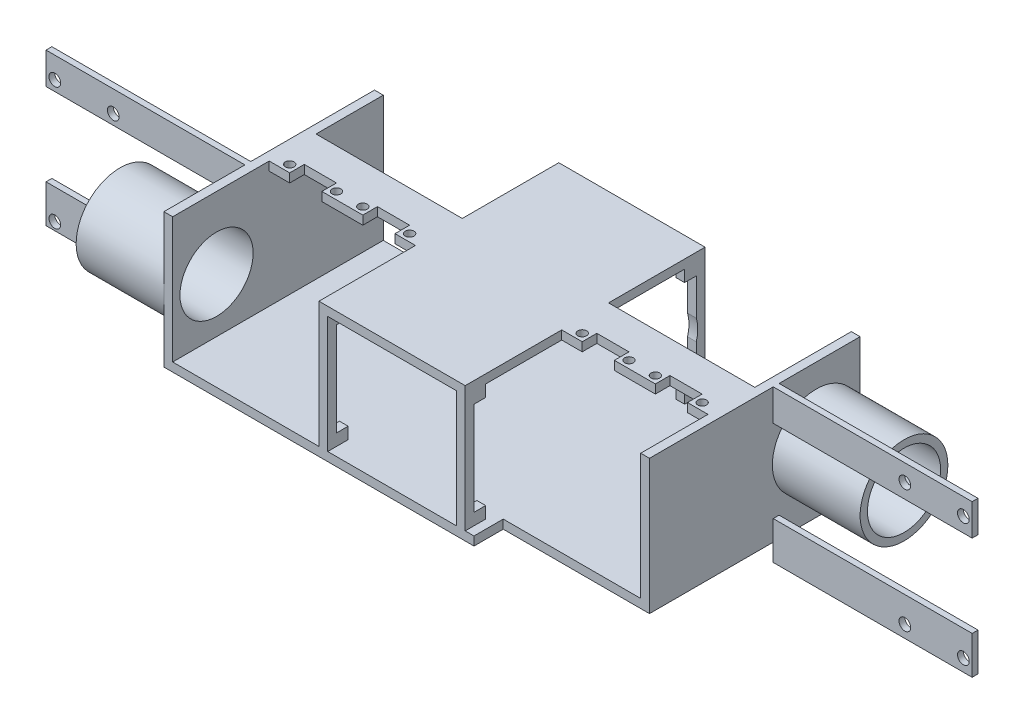
from build123d import *

# Parameters (mm, degrees)
SKETCH1_W               = 50
SKETCH1_H               = 46
BOSS_EXTRUDE1_DEPTH     = 41
CUT_EXTRUDE1_REACH      = 90.758
SKETCH2_W               = 44
SKETCH2_H               = 40
CUT_EXTRUDE2_DEPTH      = 69.629439747
CUT_EXTRUDE2_DEPTH_BACK = 69.629439747
SKETCH4_W               = 82
SKETCH4_H               = 3
BOSS_EXTRUDE2_DEPTH     = 50
SKETCH7_W               = 16
SKETCH7_H               = 3
BOSS_EXTRUDE4_DEPTH     = 50
SKETCH8_W               = 82
SKETCH8_H               = 46
BOSS_EXTRUDE5_DEPTH     = 3
CUT_EXTRUDE4_START      = -3
CUT_EXTRUDE4_DEPTH      = 103.403219264
CUT_EXTRUDE5_REACH      = 101.403
SKETCH10_W              = 11
SKETCH10_H              = 5
CUT_EXTRUDE6_REACH      = 101.403
SKETCH11_R              = 1.5
SKETCH12_R              = 15
BOSS_EXTRUDE6_DEPTH     = 30
SKETCH13_R              = 12.5
CUT_EXTRUDE7_DEPTH      = 142.063815346
SKETCH14_W              = 2
SKETCH14_H              = 10.8
SKETCH14_H_2            = 13
BOSS_EXTRUDE7_DEPTH     = 68
SKETCH16_R              = 15
BOSS_EXTRUDE8_DEPTH     = 30
CUT_EXTRUDE9_REACH      = 260.917
SKETCH17_R              = 12.5
SKETCH18_W              = 2
SKETCH18_H              = 10.8
BOSS_EXTRUDE9_DEPTH     = 68
SKETCH19_W              = 2
SKETCH19_H              = 13
BOSS_EXTRUDE10_DEPTH    = 68
CUT_EXTRUDE10_REACH     = 160.447
SKETCH15_R              = 2
CUT_EXTRUDE11_REACH     = 160.447
SKETCH20_R              = 2
CUT_EXTRUDE12_REACH     = 160.471
SKETCH21_W              = 50
SKETCH21_H              = 10
CUT_EXTRUDE13_REACH     = 160.471
SKETCH22_W              = 50
SKETCH22_H              = 10


with BuildPart() as part:
    # Sketch1 → Boss-Extrude1 (new, symmetric)
    with BuildSketch(Plane.XY):
        Rectangle(SKETCH1_W, SKETCH1_H)
    extrude(amount=BOSS_EXTRUDE1_DEPTH, both=True)

    # Sketch2 → Cut-Extrude1 (cut, up to next)
    with BuildSketch(Plane.XY.offset(41), mode=Mode.PRIVATE) as cut_extrude1_sk1:
        Rectangle(SKETCH2_W, SKETCH2_H)
    cut_extrude1_tool1 = extrude(cut_extrude1_sk1.sketch, amount=-CUT_EXTRUDE1_REACH, mode=Mode.PRIVATE) & part.part
    add(cut_extrude1_tool1.solids().sort_by_distance((0, 0, 41))[0], mode=Mode.SUBTRACT)

    # Sketch3 → Cut-Extrude2 (cut, two sides: drawn at the far end of the back side and taken through both)
    with BuildSketch(Plane.ZY.offset(25).offset(-CUT_EXTRUDE2_DEPTH_BACK)):
        Polygon((-34, 16), (-34, 20), (34, 20), (34, 16), (38, 16), (38, -16), (34, -16), (34, -20), (-34, -20), (-34, -16), (-38, -16), (-38, 16), align=None)
    extrude(amount=CUT_EXTRUDE2_DEPTH + CUT_EXTRUDE2_DEPTH_BACK, mode=Mode.SUBTRACT)

    # Sketch4 → Boss-Extrude2 (add)
    with BuildSketch(Plane(origin=(25, 0, 0), x_dir=(0, 0, -1), z_dir=(1, 0, 0))):
        with Locations((0, -21.5)):
            Rectangle(SKETCH4_W, SKETCH4_H)
    boss_extrude2 = extrude(amount=BOSS_EXTRUDE2_DEPTH)

    # Sketch7 → Boss-Extrude4 (add)
    with BuildSketch(Plane(origin=(25, 0, 0), x_dir=(0, 0, -1), z_dir=(1, 0, 0))):
        with Locations((0, 21.5)):
            Rectangle(SKETCH7_W, SKETCH7_H)
    boss_extrude4 = extrude(amount=BOSS_EXTRUDE4_DEPTH)

    # Sketch8 → Boss-Extrude5 (add)
    with BuildSketch(Plane(origin=(75, 0, 0), x_dir=(0, 0, -1), z_dir=(1, 0, 0))):
        Rectangle(SKETCH8_W, SKETCH8_H)
    boss_extrude5 = extrude(amount=BOSS_EXTRUDE5_DEPTH)

    # Sketch9 → Cut-Extrude4 (cut)
    with BuildSketch(Plane(origin=(0, 23, 0), x_dir=(1, 0, 0), z_dir=(0, 1, 0)).offset(CUT_EXTRUDE4_START)):
        Polygon((68, -228.237960416), (68, -8), (68, -3), (57, -3), (57, -8), (57, -228.237960416), (57, -668.713881249), (68, -668.713881249), align=None)
    cut_extrude4 = extrude(amount=CUT_EXTRUDE4_DEPTH, mode=Mode.SUBTRACT)

    # Sketch10 → Cut-Extrude5 (cut, up to next)
    with BuildSketch(Plane(origin=(0, 23, 0), x_dir=(1, 0, 0), z_dir=(0, 1, 0)), mode=Mode.PRIVATE) as cut_extrude5_sk1:
        with Locations((37.5, -5.5)):
            Rectangle(SKETCH10_W, SKETCH10_H)
    cut_extrude5_tool1 = extrude(cut_extrude5_sk1.sketch, amount=-CUT_EXTRUDE5_REACH, mode=Mode.PRIVATE) & part.part
    cut_extrude5 = cut_extrude5_tool1.solids().sort_by_distance((37.5, 23, 5.5))[0]
    add(cut_extrude5, mode=Mode.SUBTRACT)

    # Sketch11 → Cut-Extrude6 (cut, up to next)
    with BuildSketch(Plane(origin=(0, 23, 0), x_dir=(1, 0, 0), z_dir=(0, 1, 0)), mode=Mode.PRIVATE) as cut_extrude6_sk1:
        with Locations(Location((29.5, -5.5, 0), (0, 0, 270))):
            Circle(SKETCH11_R)
    cut_extrude6_tool1 = extrude(cut_extrude6_sk1.sketch, amount=-CUT_EXTRUDE6_REACH, mode=Mode.PRIVATE) & part.part
    # Sketch11 → Cut-Extrude6 (cut, up to next)
    with BuildSketch(Plane(origin=(0, 23, 0), x_dir=(1, 0, 0), z_dir=(0, 1, 0)), mode=Mode.PRIVATE) as cut_extrude6_sk2:
        with Locations(Location((45.5, -5.5, 0), (0, 0, 270))):
            Circle(SKETCH11_R)
    cut_extrude6_tool2 = extrude(cut_extrude6_sk2.sketch, amount=-CUT_EXTRUDE6_REACH, mode=Mode.PRIVATE) & part.part
    # Sketch11 → Cut-Extrude6 (cut, up to next)
    with BuildSketch(Plane(origin=(0, 23, 0), x_dir=(1, 0, 0), z_dir=(0, 1, 0)), mode=Mode.PRIVATE) as cut_extrude6_sk3:
        with Locations(Location((54.5, -5.5, 0), (0, 0, 270))):
            Circle(SKETCH11_R)
    cut_extrude6_tool3 = extrude(cut_extrude6_sk3.sketch, amount=-CUT_EXTRUDE6_REACH, mode=Mode.PRIVATE) & part.part
    # Sketch11 → Cut-Extrude6 (cut, up to next)
    with BuildSketch(Plane(origin=(0, 23, 0), x_dir=(1, 0, 0), z_dir=(0, 1, 0)), mode=Mode.PRIVATE) as cut_extrude6_sk4:
        with Locations(Location((70.5, -5.5, 0), (0, 0, 270))):
            Circle(SKETCH11_R)
    cut_extrude6_tool4 = extrude(cut_extrude6_sk4.sketch, amount=-CUT_EXTRUDE6_REACH, mode=Mode.PRIVATE) & part.part
    cut_extrude6_1 = cut_extrude6_tool1.solids().sort_by_distance((29.5, 23, 5.5))[0]
    add(cut_extrude6_1, mode=Mode.SUBTRACT)
    cut_extrude6_2 = cut_extrude6_tool2.solids().sort_by_distance((45.5, 23, 5.5))[0]
    add(cut_extrude6_2, mode=Mode.SUBTRACT)
    cut_extrude6_3 = cut_extrude6_tool3.solids().sort_by_distance((54.5, 23, 5.5))[0]
    add(cut_extrude6_3, mode=Mode.SUBTRACT)
    cut_extrude6_4 = cut_extrude6_tool4.solids().sort_by_distance((70.5, 23, 5.5))[0]
    add(cut_extrude6_4, mode=Mode.SUBTRACT)
    cut_extrude6 = cut_extrude6_1 + cut_extrude6_2 + cut_extrude6_3 + cut_extrude6_4  # Cut-Extrude6 as one shape, for the pattern or mirror that repeats it

    # Sketch12 → Boss-Extrude6 (add)
    with BuildSketch(Plane(origin=(78, 0, 0), x_dir=(0, 0, -1), z_dir=(1, 0, 0))):
        with Locations((26, 0)):
            Circle(SKETCH12_R)
    extrude(amount=BOSS_EXTRUDE6_DEPTH)

    # Sketch13 → Cut-Extrude7 (cut, through all)
    with BuildSketch(Plane(origin=(108, 0, 0), x_dir=(0, 0, -1), z_dir=(1, 0, 0))):
        with Locations((26, 0)):
            Circle(SKETCH13_R)
    extrude(amount=-CUT_EXTRUDE7_DEPTH, mode=Mode.SUBTRACT)

    # Sketch14 → Boss-Extrude7 (add)
    with BuildSketch(Plane(origin=(78, 0, 0), x_dir=(0, 0, -1), z_dir=(1, 0, 0))):
        with Locations((12.3, 17.6)):
            Rectangle(SKETCH14_W, SKETCH14_H)
        with Locations((12.3, -22.5)):
            Rectangle(SKETCH14_W, SKETCH14_H_2)
    extrude(amount=BOSS_EXTRUDE7_DEPTH)

    # Mirror1: Boss-Extrude2, Boss-Extrude4, Boss-Extrude5, Cut-Extrude4, Cut-Extrude5, Cut-Extrude6 across plane
    add(boss_extrude2.mirror(Plane(origin=(0, 0, 0), x_dir=(0, 0, 1), z_dir=(1, 0, 0))))
    add(boss_extrude4.mirror(Plane(origin=(0, 0, 0), x_dir=(0, 0, 1), z_dir=(1, 0, 0))))
    add(boss_extrude5.mirror(Plane(origin=(0, 0, 0), x_dir=(0, 0, 1), z_dir=(1, 0, 0))))
    add(cut_extrude4.mirror(Plane(origin=(0, 0, 0), x_dir=(0, 0, 1), z_dir=(1, 0, 0))), mode=Mode.SUBTRACT)
    add(cut_extrude5.mirror(Plane(origin=(0, 0, 0), x_dir=(0, 0, 1), z_dir=(1, 0, 0))), mode=Mode.SUBTRACT)
    add(cut_extrude6.mirror(Plane(origin=(0, 0, 0), x_dir=(0, 0, 1), z_dir=(1, 0, 0))), mode=Mode.SUBTRACT)

    # Sketch16 → Boss-Extrude8 (add)
    with BuildSketch(Plane.ZY.offset(78)):
        with Locations((26, -1.505120408)):
            Circle(SKETCH16_R)
    extrude(amount=BOSS_EXTRUDE8_DEPTH)

    # Sketch17 → Cut-Extrude9 (cut, up to next)
    with BuildSketch(Plane.ZY.offset(108), mode=Mode.PRIVATE) as cut_extrude9_sk1:
        with Locations((26, -1.505120408)):
            Circle(SKETCH17_R)
    cut_extrude9_tool1 = extrude(cut_extrude9_sk1.sketch, amount=-CUT_EXTRUDE9_REACH, mode=Mode.PRIVATE) & part.part
    add(cut_extrude9_tool1.solids().sort_by_distance((-108, -1.50512, 26))[0], mode=Mode.SUBTRACT)

    # Sketch18 → Boss-Extrude9 (add)
    with BuildSketch(Plane.ZY.offset(78)):
        with Locations((12.3, 17.6)):
            Rectangle(SKETCH18_W, SKETCH18_H)
    extrude(amount=BOSS_EXTRUDE9_DEPTH)

    # Sketch19 → Boss-Extrude10 (add)
    with BuildSketch(Plane.ZY.offset(78)):
        with Locations((12.3, -22.5)):
            Rectangle(SKETCH19_W, SKETCH19_H)
    extrude(amount=BOSS_EXTRUDE10_DEPTH)

    # Sketch15 → Cut-Extrude10 (cut, up to next)
    with BuildSketch(Plane(origin=(0, 0, -13.3), x_dir=(-1, 0, 0), z_dir=(0, 0, -1)), mode=Mode.PRIVATE) as cut_extrude10_sk1:
        with Locations(Location((-143, -24.8, 0), (0, 0, 90))):
            Circle(SKETCH15_R)
    cut_extrude10_tool1 = extrude(cut_extrude10_sk1.sketch, amount=-CUT_EXTRUDE10_REACH, mode=Mode.PRIVATE) & part.part
    # Sketch15 → Cut-Extrude10 (cut, up to next)
    with BuildSketch(Plane(origin=(0, 0, -13.3), x_dir=(-1, 0, 0), z_dir=(0, 0, -1)), mode=Mode.PRIVATE) as cut_extrude10_sk2:
        with Locations(Location((-123, -24.8, 0), (0, 0, 90))):
            Circle(SKETCH15_R)
    cut_extrude10_tool2 = extrude(cut_extrude10_sk2.sketch, amount=-CUT_EXTRUDE10_REACH, mode=Mode.PRIVATE) & part.part
    # Sketch15 → Cut-Extrude10 (cut, up to next)
    with BuildSketch(Plane(origin=(0, 0, -13.3), x_dir=(-1, 0, 0), z_dir=(0, 0, -1)), mode=Mode.PRIVATE) as cut_extrude10_sk3:
        with Locations(Location((-123, 17.2, 0), (0, 0, 90))):
            Circle(SKETCH15_R)
    cut_extrude10_tool3 = extrude(cut_extrude10_sk3.sketch, amount=-CUT_EXTRUDE10_REACH, mode=Mode.PRIVATE) & part.part
    # Sketch15 → Cut-Extrude10 (cut, up to next)
    with BuildSketch(Plane(origin=(0, 0, -13.3), x_dir=(-1, 0, 0), z_dir=(0, 0, -1)), mode=Mode.PRIVATE) as cut_extrude10_sk4:
        with Locations(Location((-143, 17.2, 0), (0, 0, 90))):
            Circle(SKETCH15_R)
    cut_extrude10_tool4 = extrude(cut_extrude10_sk4.sketch, amount=-CUT_EXTRUDE10_REACH, mode=Mode.PRIVATE) & part.part
    add(cut_extrude10_tool1.solids().sort_by_distance((143, -24.8, -13.3))[0], mode=Mode.SUBTRACT)
    add(cut_extrude10_tool2.solids().sort_by_distance((123, -24.8, -13.3))[0], mode=Mode.SUBTRACT)
    add(cut_extrude10_tool3.solids().sort_by_distance((123, 17.2, -13.3))[0], mode=Mode.SUBTRACT)
    add(cut_extrude10_tool4.solids().sort_by_distance((143, 17.2, -13.3))[0], mode=Mode.SUBTRACT)

    # Sketch20 → Cut-Extrude11 (cut, up to next)
    with BuildSketch(Plane.XY.offset(13.3), mode=Mode.PRIVATE) as cut_extrude11_sk1:
        with Locations((-123, 15.694879592)):
            Circle(SKETCH20_R)
    cut_extrude11_tool1 = extrude(cut_extrude11_sk1.sketch, amount=-CUT_EXTRUDE11_REACH, mode=Mode.PRIVATE) & part.part
    # Sketch20 → Cut-Extrude11 (cut, up to next)
    with BuildSketch(Plane.XY.offset(13.3), mode=Mode.PRIVATE) as cut_extrude11_sk2:
        with Locations((-143, 15.694879592)):
            Circle(SKETCH20_R)
    cut_extrude11_tool2 = extrude(cut_extrude11_sk2.sketch, amount=-CUT_EXTRUDE11_REACH, mode=Mode.PRIVATE) & part.part
    # Sketch20 → Cut-Extrude11 (cut, up to next)
    with BuildSketch(Plane.XY.offset(13.3), mode=Mode.PRIVATE) as cut_extrude11_sk3:
        with Locations((-123, -26.305120408)):
            Circle(SKETCH20_R)
    cut_extrude11_tool3 = extrude(cut_extrude11_sk3.sketch, amount=-CUT_EXTRUDE11_REACH, mode=Mode.PRIVATE) & part.part
    # Sketch20 → Cut-Extrude11 (cut, up to next)
    with BuildSketch(Plane.XY.offset(13.3), mode=Mode.PRIVATE) as cut_extrude11_sk4:
        with Locations((-143, -26.305120408)):
            Circle(SKETCH20_R)
    cut_extrude11_tool4 = extrude(cut_extrude11_sk4.sketch, amount=-CUT_EXTRUDE11_REACH, mode=Mode.PRIVATE) & part.part
    add(cut_extrude11_tool1.solids().sort_by_distance((-123, 15.69488, 13.3))[0], mode=Mode.SUBTRACT)
    add(cut_extrude11_tool2.solids().sort_by_distance((-143, 15.69488, 13.3))[0], mode=Mode.SUBTRACT)
    add(cut_extrude11_tool3.solids().sort_by_distance((-123, -26.30512, 13.3))[0], mode=Mode.SUBTRACT)
    add(cut_extrude11_tool4.solids().sort_by_distance((-143, -26.30512, 13.3))[0], mode=Mode.SUBTRACT)

    # Sketch21 → Cut-Extrude12 (cut, up to next)
    with BuildSketch(Plane.XZ.offset(23), mode=Mode.PRIVATE) as cut_extrude12_sk1:
        with Locations((-53, -36)):
            Rectangle(SKETCH21_W, SKETCH21_H)
    cut_extrude12_tool1 = extrude(cut_extrude12_sk1.sketch, amount=-CUT_EXTRUDE12_REACH, mode=Mode.PRIVATE) & part.part
    add(cut_extrude12_tool1.solids().sort_by_distance((-53, -23, -36))[0], mode=Mode.SUBTRACT)

    # Sketch22 → Cut-Extrude13 (cut, up to next)
    with BuildSketch(Plane(origin=(0, -23, 0), x_dir=(-1, 0, 0), z_dir=(0, -1, 0)), mode=Mode.PRIVATE) as cut_extrude13_sk1:
        with Locations((-53, -36)):
            Rectangle(SKETCH22_W, SKETCH22_H)
    cut_extrude13_tool1 = extrude(cut_extrude13_sk1.sketch, amount=-CUT_EXTRUDE13_REACH, mode=Mode.PRIVATE) & part.part
    add(cut_extrude13_tool1.solids().sort_by_distance((53, -23, 36))[0], mode=Mode.SUBTRACT)


solid = part.part
